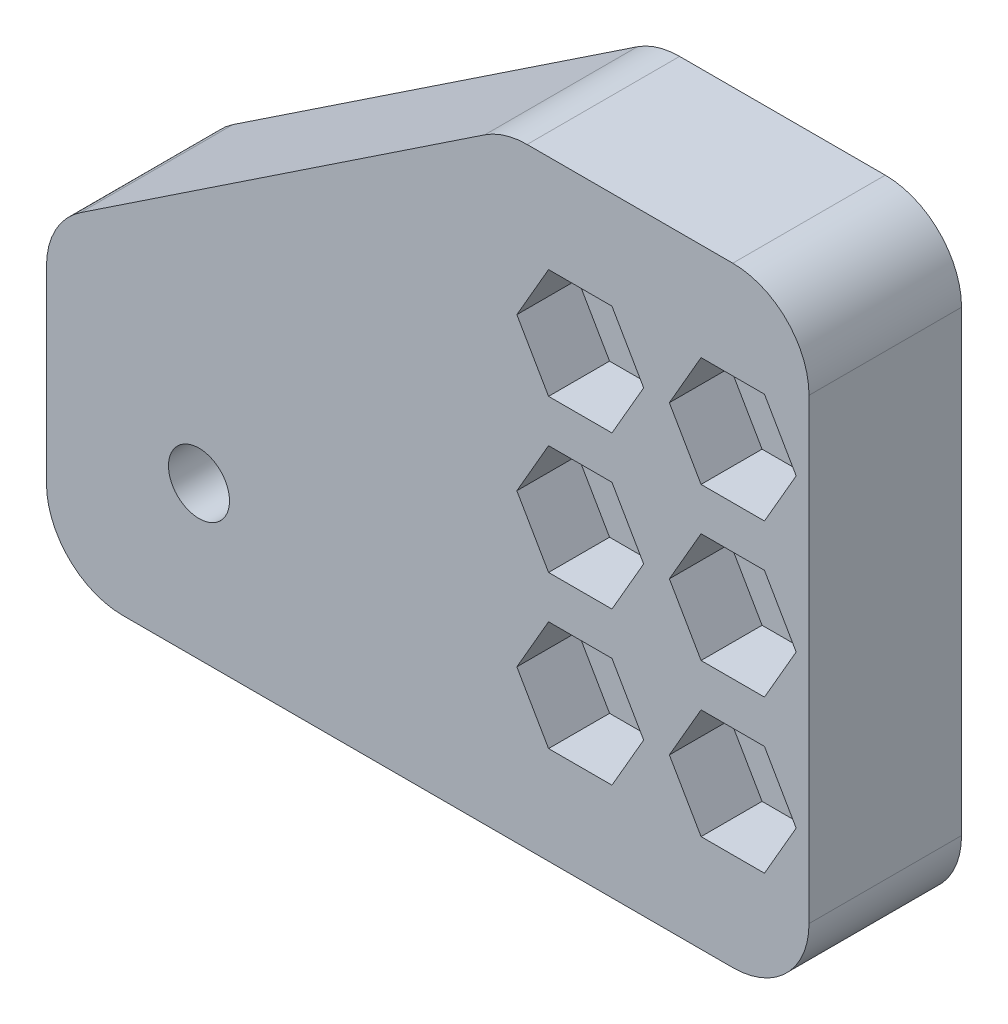
from build123d import *

# Parameters (mm, degrees)
SKETCH1_R           = 2.286
SKETCH1_R_2         = 2.54
BOSS_EXTRUDE1_DEPTH = 12.7
FILLET1_R           = 6.35
CUT_EXTRUDE1_DEPTH  = 8.89
FILLET2_R           = 2.54
CUT_EXTRUDE2_DEPTH  = 5.08


with BuildPart() as part:
    # Sketch1 → Boss-Extrude1 (new body)
    with BuildSketch(Plane.XY):
        Polygon((-6.35, 38.1), (-44.45, 12.7), (-44.45, -12.7), (-6.35, -12.7), (19.05, -12.7), (19.05, 38.1), align=None)
        Circle(SKETCH1_R, mode=Mode.SUBTRACT)
        with Locations((-31.75, 0)):
            Circle(SKETCH1_R_2, mode=Mode.SUBTRACT)
        with Locations((12.7, 0)):
            Circle(SKETCH1_R, mode=Mode.SUBTRACT)
        with Locations((12.7, 12.7)):
            Circle(SKETCH1_R, mode=Mode.SUBTRACT)
        with Locations((12.7, 25.4)):
            Circle(SKETCH1_R, mode=Mode.SUBTRACT)
        with Locations((0, 12.7)):
            Circle(SKETCH1_R, mode=Mode.SUBTRACT)
        with Locations((0, 25.4)):
            Circle(SKETCH1_R, mode=Mode.SUBTRACT)
    extrude(amount=BOSS_EXTRUDE1_DEPTH)

    # Fillet1
    fillet1_edges = [part.edges().sort_by_distance(p)[0] for p in [
        (-44.45, -12.7, 6.35),
        (-44.45, 12.7, 6.35),
        (-6.35, 38.1, 6.35),
        (19.05, 38.1, 6.35),
        (19.05, -12.7, 6.35),
    ]]
    fillet(fillet1_edges, radius=FILLET1_R)

    # Sketch2 → Cut-Extrude1 (cut)
    with BuildSketch(Plane(origin=(-5.08, 0, 0), x_dir=(0, 0, -1), z_dir=(1, 0, 0))):
        Polygon((0, 3.81), (-11.560426456, -12.7), (0, -12.7), align=None)
    extrude(amount=-CUT_EXTRUDE1_DEPTH, mode=Mode.SUBTRACT)

    # Fillet2
    fillet2_edges = [part.edges().sort_by_distance(p)[0] for p in [
        (-13.97, -4.445, 0),
        (-13.97, -12.7, 5.780213228),
        (-5.08, -4.445, 0),
        (-5.08, -12.7, 5.780213228),
    ]]
    fillet(fillet2_edges, radius=FILLET2_R)

    # Sketch3 → Cut-Extrude2 (cut)
    with BuildSketch(Plane.XY.offset(12.7)):
        Polygon((17.979290861, 0), (15.339645431, 4.572), (10.060354569, 4.572), (7.420709139, 0), (10.060354569, -4.572), (15.339645431, -4.572), align=None)
        Polygon((5.279290861, 0), (2.639645431, 4.572), (-2.639645431, 4.572), (-5.279290861, 0), (-2.639645431, -4.572), (2.639645431, -4.572), align=None)
        Polygon((17.979290861, 12.7), (15.339645431, 17.272), (10.060354569, 17.272), (7.420709139, 12.7), (10.060354569, 8.128), (15.339645431, 8.128), align=None)
        Polygon((17.979290861, 25.4), (15.339645431, 29.972), (10.060354569, 29.972), (7.420709139, 25.4), (10.060354569, 20.828), (15.339645431, 20.828), align=None)
        Polygon((5.279290861, 12.7), (2.639645431, 17.272), (-2.639645431, 17.272), (-5.279290861, 12.7), (-2.639645431, 8.128), (2.639645431, 8.128), align=None)
        Polygon((5.279290861, 25.4), (2.639645431, 29.972), (-2.639645431, 29.972), (-5.279290861, 25.4), (-2.639645431, 20.828), (2.639645431, 20.828), align=None)
    extrude(amount=-CUT_EXTRUDE2_DEPTH, mode=Mode.SUBTRACT)


solid = part.part
